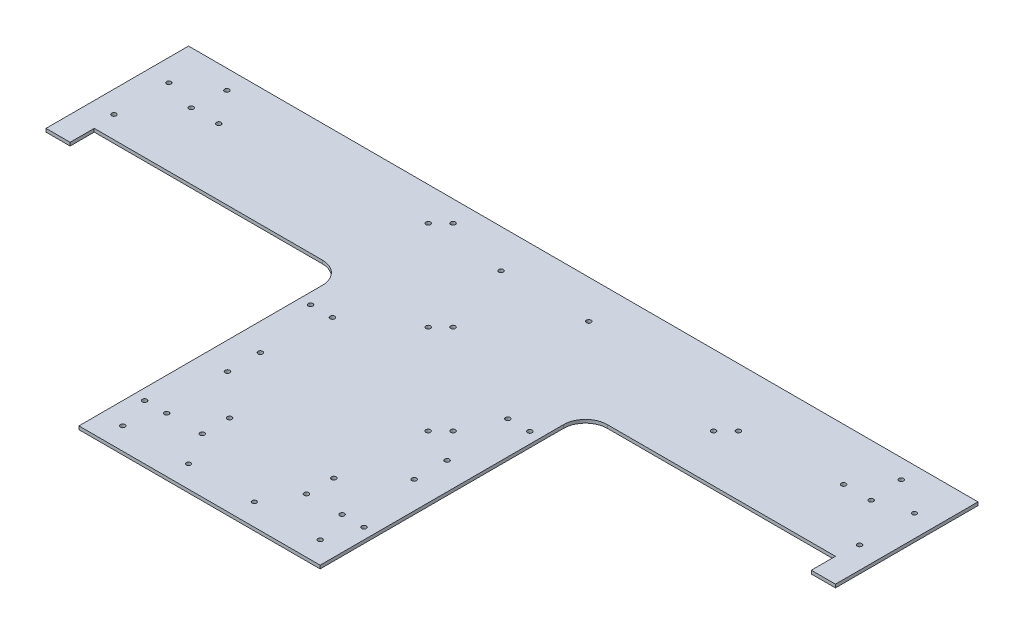
from build123d import *

# Parameters (mm, degrees)
BOSS_EXTRUDE1_DEPTH = 3
SKETCH2_R           = 2.125
CUT_EXTRUDE1_DEPTH  = 503.104570782
SKETCH3_R           = 2
CUT_EXTRUDE2_DEPTH  = 503.104570782
SKETCH5_R           = 2.125
CUT_EXTRUDE4_DEPTH  = 10
FILLET1_R           = 20
SKETCH6_R           = 2.125
CUT_EXTRUDE5_DEPTH  = 503.104570782
SKETCH8_R           = 2.1
CUT_EXTRUDE6_DEPTH  = 10
SKETCH7_R           = 2.1
CUT_EXTRUDE7_DEPTH  = 10
SKETCH9_W           = 720
SKETCH9_H           = 350
CUT_EXTRUDE8_DEPTH  = 10


with BuildPart() as part:
    # Sketch1 → Boss-Extrude1 (new body)
    with BuildSketch(Plane(origin=(0, 0, 0), x_dir=(1, 0, 0), z_dir=(0, 1, 0))):
        Polygon((-110, 350), (-110, 108), (-338, 108), (-338, 130), (-360, 130), (-360, -130), (-338, -130), (-338, -108), (-110, -108), (-110, -350), (110, -350), (110, -108), (338, -108), (338, -130), (360, -130), (360, 130), (338, 130), (338, 108), (110, 108), (110, 350), align=None)
    extrude(amount=BOSS_EXTRUDE1_DEPTH)

    # Sketch2 → Cut-Extrude1 (cut, through all)
    with BuildSketch(Plane(origin=(0, 3, 0), x_dir=(1, 0, 0), z_dir=(0, 1, 0))):
        with Locations(Location((310, 47.5, 0), (0, 0, 270))):
            Circle(SKETCH2_R)
        with Locations(Location((285, 47.5, 0), (0, 0, 270))):
            Circle(SKETCH2_R)
        with Locations(Location((307.5, 17.5, 0), (0, 0, 270))):
            Circle(SKETCH2_R)
        with Locations(Location((307.5, -17.5, 0), (0, 0, 270))):
            Circle(SKETCH2_R)
        with Locations(Location((310, -47.5, 0), (0, 0, 270))):
            Circle(SKETCH2_R)
        with Locations(Location((285, -47.5, 0), (0, 0, 270))):
            Circle(SKETCH2_R)
        with Locations(Location((-285, -47.5, 0), (0, 0, 90))):
            Circle(SKETCH2_R)
        with Locations(Location((-310, -47.5, 0), (0, 0, 90))):
            Circle(SKETCH2_R)
        with Locations(Location((-307.5, -17.5, 0), (0, 0, 90))):
            Circle(SKETCH2_R)
        with Locations(Location((-307.5, 17.5, 0), (0, 0, 90))):
            Circle(SKETCH2_R)
        with Locations(Location((-285, 47.5, 0), (0, 0, 90))):
            Circle(SKETCH2_R)
        with Locations(Location((-310, 47.5, 0), (0, 0, 90))):
            Circle(SKETCH2_R)
        with Locations(Location((47.5, 300, 0), (0, 0, 270))):
            Circle(SKETCH2_R)
        with Locations(Location((47.5, 275, 0), (0, 0, 270))):
            Circle(SKETCH2_R)
        with Locations(Location((-47.5, 275, 0), (0, 0, 90))):
            Circle(SKETCH2_R)
        with Locations(Location((-47.5, 300, 0), (0, 0, 90))):
            Circle(SKETCH2_R)
        with Locations(Location((-47.5, -300, 0), (0, 0, 270))):
            Circle(SKETCH2_R)
        with Locations(Location((-47.5, -275, 0), (0, 0, 270))):
            Circle(SKETCH2_R)
        with Locations(Location((47.5, -275, 0), (0, 0, 90))):
            Circle(SKETCH2_R)
        with Locations(Location((47.5, -300, 0), (0, 0, 90))):
            Circle(SKETCH2_R)
    extrude(amount=-CUT_EXTRUDE1_DEPTH, mode=Mode.SUBTRACT)

    # Sketch3 → Cut-Extrude2 (cut, through all)
    with BuildSketch(Plane(origin=(0, 3, 0), x_dir=(1, 0, 0), z_dir=(0, 1, 0))):
        with Locations(Location((340, 38, 0), (0, 0, 270))):
            Circle(SKETCH3_R)
        with Locations(Location((340, -38, 0), (0, 0, 90))):
            Circle(SKETCH3_R)
        with Locations(Location((-340, -38, 0), (0, 0, 270))):
            Circle(SKETCH3_R)
        with Locations(Location((-340, 38, 0), (0, 0, 90))):
            Circle(SKETCH3_R)
        with Locations(Location((-30, 330, 0), (0, 0, 270))):
            Circle(SKETCH3_R)
        with Locations(Location((30, 330, 0), (0, 0, 90))):
            Circle(SKETCH3_R)
        with Locations(Location((30, -330, 0), (0, 0, 270))):
            Circle(SKETCH3_R)
        with Locations(Location((-30, -330, 0), (0, 0, 90))):
            Circle(SKETCH3_R)
    extrude(amount=-CUT_EXTRUDE2_DEPTH, mode=Mode.SUBTRACT)

    # Sketch5 → Cut-Extrude4 (cut)
    with BuildSketch(Plane(origin=(0, 3, 0), x_dir=(1, 0, 0), z_dir=(0, 1, 0))):
        with Locations(Location((80, 300, 0), (0, 0, 270))):
            Circle(SKETCH5_R)
        with Locations(Location((80, 148.73, 0), (0, 0, 270))):
            Circle(SKETCH5_R)
        with Locations(Location((85.11, 239.365, 0), (0, 0, 270))):
            Circle(SKETCH5_R)
        with Locations(Location((85.11, 209.365, 0), (0, 0, 270))):
            Circle(SKETCH5_R)
        with Locations(Location((100, 148.73, 0), (0, 0, 90))):
            Circle(SKETCH5_R)
        with Locations(Location((100, 300, 0), (0, 0, 90))):
            Circle(SKETCH5_R)
        with Locations(Location((-100, 300, 0), (0, 0, 270))):
            Circle(SKETCH5_R)
        with Locations(Location((-100, 148.73, 0), (0, 0, 270))):
            Circle(SKETCH5_R)
        with Locations(Location((-85.11, 209.365, 0), (0, 0, 90))):
            Circle(SKETCH5_R)
        with Locations(Location((-85.11, 239.365, 0), (0, 0, 90))):
            Circle(SKETCH5_R)
        with Locations(Location((-80, 148.73, 0), (0, 0, 90))):
            Circle(SKETCH5_R)
        with Locations(Location((-80, 300, 0), (0, 0, 90))):
            Circle(SKETCH5_R)
        with Locations(Location((-80, -300, 0), (0, 0, 270))):
            Circle(SKETCH5_R)
        with Locations(Location((-80, -148.73, 0), (0, 0, 270))):
            Circle(SKETCH5_R)
        with Locations(Location((-85.11, -239.365, 0), (0, 0, 270))):
            Circle(SKETCH5_R)
        with Locations(Location((-85.11, -209.365, 0), (0, 0, 270))):
            Circle(SKETCH5_R)
        with Locations(Location((-100, -148.73, 0), (0, 0, 90))):
            Circle(SKETCH5_R)
        with Locations(Location((-100, -300, 0), (0, 0, 90))):
            Circle(SKETCH5_R)
        with Locations(Location((100, -300, 0), (0, 0, 270))):
            Circle(SKETCH5_R)
        with Locations(Location((100, -148.73, 0), (0, 0, 270))):
            Circle(SKETCH5_R)
        with Locations(Location((85.11, -209.365, 0), (0, 0, 90))):
            Circle(SKETCH5_R)
        with Locations(Location((85.11, -239.365, 0), (0, 0, 90))):
            Circle(SKETCH5_R)
        with Locations(Location((80, -148.73, 0), (0, 0, 90))):
            Circle(SKETCH5_R)
        with Locations(Location((80, -300, 0), (0, 0, 90))):
            Circle(SKETCH5_R)
    extrude(amount=-CUT_EXTRUDE4_DEPTH, mode=Mode.SUBTRACT)

    # Fillet1
    fillet1_edges = [part.edges().sort_by_distance(p)[0] for p in [
        (110, 1.5, -108),
        (110, 1.5, 108),
        (-110, 1.5, 108),
        (-110, 1.5, -108),
    ]]
    fillet(fillet1_edges, radius=FILLET1_R)

    # Sketch6 → Cut-Extrude5 (cut, through all)
    with BuildSketch(Plane(origin=(0, 3, 0), x_dir=(1, 0, 0), z_dir=(0, 1, 0))):
        with Locations(Location((53.325901808, -194.747258045, 0), (0, 0, 270))):
            Circle(SKETCH6_R)
        with Locations(Location((-192.747258045, 51.325901808, 0), (0, 0, 270))):
            Circle(SKETCH6_R)
        with Locations(Location((-28.69848481, -112.722871427, 0), (0, 0, 270))):
            Circle(SKETCH6_R)
        with Locations(Location((-110.722871427, -30.69848481, 0), (0, 0, 270))):
            Circle(SKETCH6_R)
        with Locations(Location((64.639610307, -183.433549546, 0), (0, 0, 90))):
            Circle(SKETCH6_R)
        with Locations(Location((-17.384776311, -101.409162928, 0), (0, 0, 90))):
            Circle(SKETCH6_R)
        with Locations(Location((-99.409162928, -19.384776311, 0), (0, 0, 90))):
            Circle(SKETCH6_R)
        with Locations(Location((-181.433549546, 62.639610307, 0), (0, 0, 90))):
            Circle(SKETCH6_R)
        with Locations(Location((-62.639610307, 181.433549546, 0), (0, 0, 270))):
            Circle(SKETCH6_R)
        with Locations(Location((19.384776311, 99.409162928, 0), (0, 0, 270))):
            Circle(SKETCH6_R)
        with Locations(Location((101.409162928, 17.384776311, 0), (0, 0, 270))):
            Circle(SKETCH6_R)
        with Locations(Location((183.433549546, -64.639610307, 0), (0, 0, 270))):
            Circle(SKETCH6_R)
        with Locations(Location((30.69848481, 110.722871427, 0), (0, 0, 90))):
            Circle(SKETCH6_R)
        with Locations(Location((112.722871427, 28.69848481, 0), (0, 0, 90))):
            Circle(SKETCH6_R)
        with Locations(Location((-51.325901808, 192.747258045, 0), (0, 0, 90))):
            Circle(SKETCH6_R)
        with Locations(Location((194.747258045, -53.325901808, 0), (0, 0, 90))):
            Circle(SKETCH6_R)
    extrude(amount=-CUT_EXTRUDE5_DEPTH, mode=Mode.SUBTRACT)

    # Sketch8 → Cut-Extrude6 (cut)
    with BuildSketch(Plane(origin=(0, 3, 0), x_dir=(1, 0, 0), z_dir=(0, 1, 0))):
        with Locations(Location((-40, 35, 0), (0, 0, 270))):
            Circle(SKETCH8_R)
        with Locations(Location((40, 35, 0), (0, 0, 90))):
            Circle(SKETCH8_R)
        with Locations(Location((40, -35, 0), (0, 0, 270))):
            Circle(SKETCH8_R)
        with Locations(Location((-40, -35, 0), (0, 0, 90))):
            Circle(SKETCH8_R)
    extrude(amount=-CUT_EXTRUDE6_DEPTH, mode=Mode.SUBTRACT)

    # Sketch7 → Cut-Extrude7 (cut)
    with BuildSketch(Plane(origin=(0, 3, 0), x_dir=(1, 0, 0), z_dir=(0, 1, 0))):
        with Locations(Location((340, 88, 0), (0, 0, 270))):
            Circle(SKETCH7_R)
        with Locations(Location((340, -88, 0), (0, 0, 90))):
            Circle(SKETCH7_R)
        with Locations(Location((-340, -88, 0), (0, 0, 270))):
            Circle(SKETCH7_R)
        with Locations(Location((-340, 88, 0), (0, 0, 90))):
            Circle(SKETCH7_R)
        with Locations(Location((-90, 330, 0), (0, 0, 270))):
            Circle(SKETCH7_R)
        with Locations(Location((90, 330, 0), (0, 0, 90))):
            Circle(SKETCH7_R)
        with Locations(Location((90, -330, 0), (0, 0, 270))):
            Circle(SKETCH7_R)
        with Locations(Location((-90, -330, 0), (0, 0, 90))):
            Circle(SKETCH7_R)
    extrude(amount=-CUT_EXTRUDE7_DEPTH, mode=Mode.SUBTRACT)

    # Sketch9 → Cut-Extrude8 (cut)
    with BuildSketch(Plane(origin=(0, 3, 0), x_dir=(1, 0, 0), z_dir=(0, 1, 0))):
        with Locations((0, 175)):
            Rectangle(SKETCH9_W, SKETCH9_H)
    extrude(amount=-CUT_EXTRUDE8_DEPTH, mode=Mode.SUBTRACT)


solid = part.part
